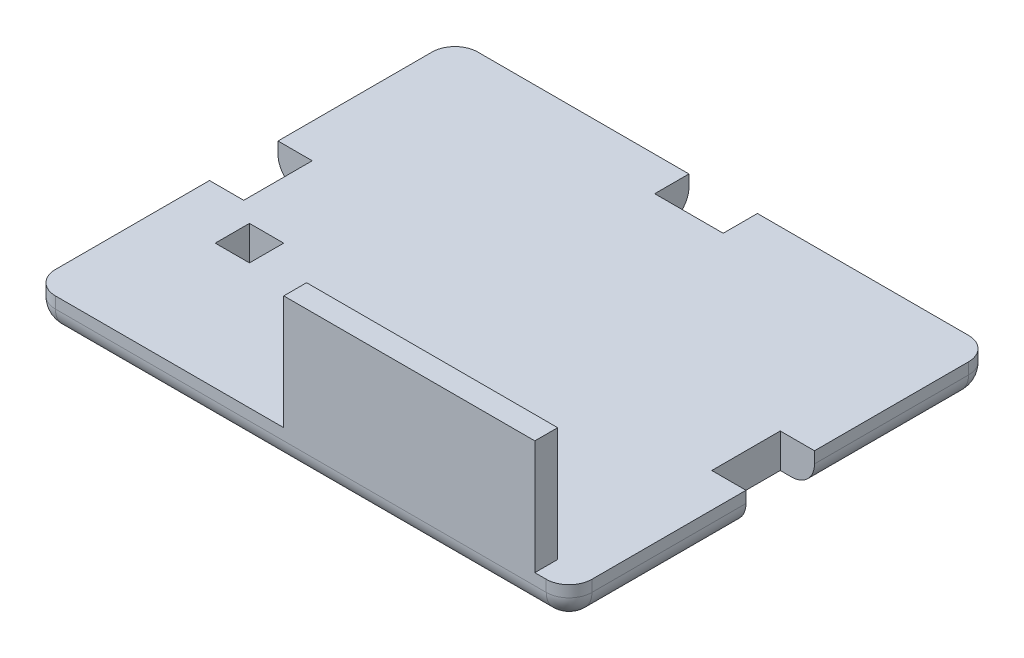
from build123d import *

# Parameters (mm, degrees)
SKETCH1_W           = 23.5
SKETCH1_H           = 18.5
BOSS_EXTRUDE1_DEPTH = 1.5
SKETCH2_W           = 3
SKETCH2_H           = 1.5
SKETCH2_W_2         = 1.5
SKETCH2_H_2         = 3
CUT_EXTRUDE1_DEPTH  = 1.5
SKETCH3_W           = 10
SKETCH3_H           = 1
BOSS_EXTRUDE2_DEPTH = 5
CUT_EXTRUDE3_DEPTH  = 0.75
SKETCH5_W           = 1.5
SKETCH5_H           = 1.5
CUT_EXTRUDE4_DEPTH  = 1.5
FILLET1_R           = 1
FILLET4_R           = 1
SKETCH7_W           = 0.998185699
SKETCH7_H           = 1
BOSS_EXTRUDE3_DEPTH = 5


with BuildPart() as part:
    # Sketch1 → Boss-Extrude1 (new body)
    with BuildSketch(Plane(origin=(0, 0, 0), x_dir=(1, 0, 0), z_dir=(0, 1, 0))):
        with Locations((-5.985849057, 1.668632075)):
            Rectangle(SKETCH1_W, SKETCH1_H)
    extrude(amount=BOSS_EXTRUDE1_DEPTH)

    # Sketch2 → Cut-Extrude1 (cut)
    with BuildSketch(Plane(origin=(0, 1.5, 0), x_dir=(1, 0, 0), z_dir=(0, 1, 0))):
        with Locations((-5.985849057, 10.168632075)):
            Rectangle(SKETCH2_W, SKETCH2_H)
        with Locations((-16.985849057, 1.668632075)):
            Rectangle(SKETCH2_W_2, SKETCH2_H_2)
        with Locations((5.014150943, 1.668632075)):
            Rectangle(SKETCH2_W_2, SKETCH2_H_2)
    extrude(amount=-CUT_EXTRUDE1_DEPTH, mode=Mode.SUBTRACT)

    # Sketch3 → Boss-Extrude2 (add)
    with BuildSketch(Plane(origin=(0, 1.5, 0), x_dir=(1, 0, 0), z_dir=(0, 1, 0))):
        with Locations((-0.735849057, -7.081367925)):
            Rectangle(SKETCH3_W, SKETCH3_H)
    extrude(amount=BOSS_EXTRUDE2_DEPTH)

    # Sketch4 → Cut-Extrude3 (cut)
    with BuildSketch(Plane.XZ):
        with BuildLine():
            Line((-1.177314548, -2.300719994), (-0.888639414, -1.800719994))
            Line((-0.888639414, -1.800719994), (-1.177314548, -1.300719994))
            Line((-1.177314548, -1.300719994), (-4.571635494, -1.300719994))
            ThreePointArc((-4.571635494, -1.300719994), (-7.046509228, -0.740059822), (-6.485849057, -3.214933557))
            Line((-6.485849057, -3.214933557), (-6.485849057, -5.700361827))
            Line((-6.485849057, -5.700361827), (-5.985849057, -5.989036962))
            Line((-5.985849057, -5.989036962), (-5.485849057, -5.700361827))
            Line((-5.485849057, -5.700361827), (-5.485849057, -3.214933557))
            ThreePointArc((-5.485849057, -3.214933557), (-4.925188885, -2.861380166), (-4.571635494, -2.300719994))
            Line((-4.571635494, -2.300719994), (-1.177314548, -2.300719994))
        make_face()
        Polygon((-7.080591406, -6.388557959), (-6.520895893, -6.388557959), (-5.968090572, -7.238171507), (-5.41422522, -6.388557959), (-4.853999693, -6.388557959), (-5.688242815, -7.668013421), (-4.798878165, -9.034391292), (-5.358573678, -9.034391292), (-5.968090572, -8.09732532), (-6.579197509, -9.034391292), (-7.139423037, -9.034391292), (-6.247938328, -7.667483406), align=None)
        Polygon((-6.848224631, 3.131460083), (-5.253940443, 3.131460083), (-6.201606709, 0.960519912), (-5.321782324, 0.960519912), (-5.321782324, 0.48562675), (-6.916066512, 0.48562675), (-5.967870231, 2.656566921), (-6.848224631, 2.656566921), align=None)
        Polygon((-0.096157656, -1.744646719), (0.43226699, -1.744646719), (0.904510079, -2.672702441), (1.376753168, -1.744646719), (1.905177814, -1.744646719), (1.14195666, -3.244588292), (1.14195666, -4.390480052), (0.667063498, -4.390480052), (0.667063498, -3.244588292), align=None)
    extrude(amount=-CUT_EXTRUDE3_DEPTH, mode=Mode.SUBTRACT)

    # Sketch5 → Cut-Extrude4 (cut)
    with BuildSketch(Plane.XZ):
        with Locations((-14.485849057, 1.331367925)):
            Rectangle(SKETCH5_W, SKETCH5_H)
    extrude(amount=-CUT_EXTRUDE4_DEPTH, mode=Mode.SUBTRACT)

    # Fillet1
    fillet1_edges = [part.edges().sort_by_distance(p)[0] for p in [
        (-12.610849057, 0, -10.918632075),
        (5.764150943, 0, -7.043632075),
        (0.639150943, 0, -10.918632075),
        (-17.735849057, 0, -7.043632075),
        (-17.735849057, 0.75, -10.918632075),
        (5.764150943, 0.75, -10.918632075),
    ]]
    fillet(fillet1_edges, radius=FILLET1_R)

    # Fillet4
    fillet4_edges = [part.edges().sort_by_distance(p)[0] for p in [
        (-17.735849057, 0, 3.706367925),
        (5.764150943, 0, 3.706367925),
        (-5.985849057, 0, 7.581367925),
        (5.764150943, 0.75, 7.581367925),
        (-17.735849057, 0.75, 7.581367925),
    ]]
    fillet(fillet4_edges, radius=FILLET4_R)

    # Sketch7 → Boss-Extrude3 (add)
    with BuildSketch(Plane(origin=(0, 1.5, 0), x_dir=(1, 0, 0), z_dir=(0, 1, 0))):
        with Locations((-6.234941907, -7.081367925)):
            Rectangle(SKETCH7_W, SKETCH7_H)
    extrude(amount=BOSS_EXTRUDE3_DEPTH)


solid = part.part
